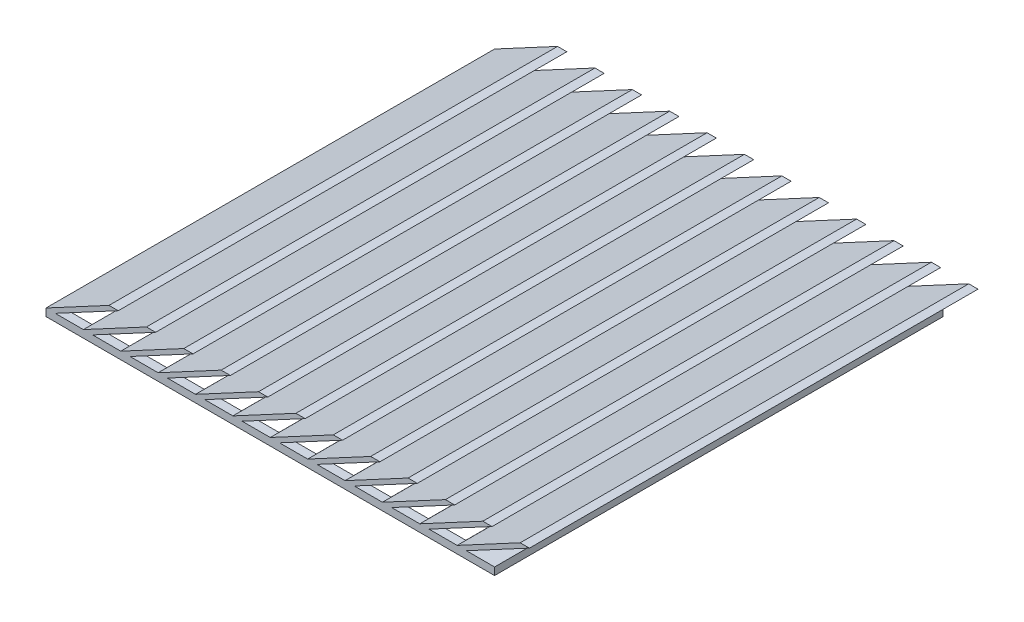
from build123d import *

# Parameters (mm, degrees)
EXTRUDE_1_DEPTH     = 120
CUT_EXTRUDE_1_DEPTH = 2


with BuildPart() as part:
    # 草图2 → 凸台-拉伸1 (new body)
    with BuildSketch(Plane.XY):
        Polygon((0, 2), (16.856230065, 11.032475858), (19.332704549, 11.032475858), (2.476474484, 2), (10, 2), (26.856230065, 11.032475858), (29.332704549, 11.032475858), (12.476474484, 2), (20, 2), (36.856230065, 11.032475858), (39.332704549, 11.032475858), (22.476474484, 2), (30, 2), (46.856230065, 11.032475858), (49.332704549, 11.032475858), (32.476474484, 2), (40, 2), (56.856230065, 11.032475858), (59.332704549, 11.032475858), (42.476474484, 2), (50, 2), (66.856230065, 11.032475858), (69.332704549, 11.032475858), (52.476474484, 2), (60, 2), (76.856230065, 11.032475858), (79.332704549, 11.032475858), (62.476474484, 2), (70, 2), (86.856230065, 11.032475858), (89.332704549, 11.032475858), (72.476474484, 2), (80, 2), (96.856230065, 11.032475858), (99.332704549, 11.032475858), (82.476474484, 2), (90, 2), (106.856230065, 11.032475858), (109.332704549, 11.032475858), (92.476474484, 2), (100, 2), (116.856230065, 11.032475858), (119.332704549, 11.032475858), (102.476474484, 2), (110, 2), (126.856230065, 11.032475858), (129.332704549, 11.032475858), (112.476474484, 2), (120, 2), (120, 0), (0, 0), align=None)
    extrude(amount=EXTRUDE_1_DEPTH)

    # 草图5 → 切除-拉伸1 (cut)
    with BuildSketch(Plane.XZ):
        Polygon((2.476402921, 117.653523678), (2.48, 2.48), (10, 2.48), (9.999928921, 117.653523678), align=None)
        Polygon((19.996402921, 117.653523678), (12.472876921, 117.653523678), (12.476474, 2.48), (19.774552048, 2.48), (19.996474, 2.48), align=None)
        Polygon((32.465824921, 117.653523678), (32.469422, 2.48), (39.323656144, 2.48), (39.989422, 2.48), (39.989350921, 117.653523678), align=None)
        Polygon((42.462298921, 117.653523678), (42.465896, 2.48), (49.098208192, 2.48), (49.985896, 2.48), (49.985824921, 117.653523678), align=None)
        Polygon((52.458772921, 117.653523678), (52.46237, 2.48), (58.87276024, 2.48), (59.98237, 2.48), (59.982298921, 117.653523678), align=None)
        Polygon((62.455246921, 117.653523678), (62.458844, 2.48), (68.647312287, 2.48), (69.978844, 2.48), (69.978772921, 117.653523678), align=None)
        Polygon((72.451720921, 117.653523678), (72.455318, 2.48), (78.421864335, 2.48), (79.975318, 2.48), (79.975246921, 117.653523678), align=None)
        Polygon((82.448194921, 117.653523678), (82.451792, 2.48), (88.196416383, 2.48), (89.971792, 2.48), (89.971720921, 117.653523678), align=None)
        Polygon((92.444668921, 117.653523678), (92.448266, 2.48), (97.970968431, 2.48), (99.968266, 2.48), (99.968194921, 117.653523678), align=None)
        Polygon((102.441142921, 117.653523678), (102.44474, 2.48), (107.745520479, 2.48), (109.96474, 2.48), (109.964668921, 117.653523678), align=None)
        Polygon((22.469350921, 117.653523678), (22.472948, 2.48), (29.992948, 2.48), (29.992876921, 117.653523678), align=None)
    extrude(amount=-CUT_EXTRUDE_1_DEPTH, mode=Mode.SUBTRACT)


solid = part.part
